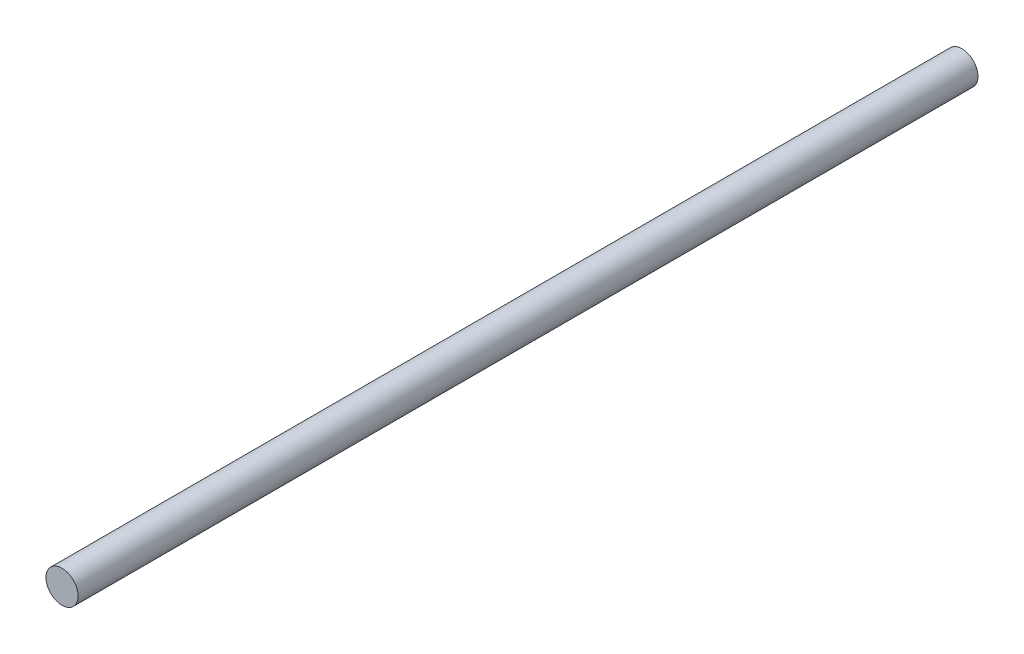
from build123d import *

# Parameters (mm, degrees)
SKETCH1_R           = 4
BOSS_EXTRUDE1_DEPTH = 112


with BuildPart() as part:
    # Sketch1 → Boss-Extrude1 (new, symmetric)
    with BuildSketch(Plane.XY):
        Circle(SKETCH1_R)
    extrude(amount=BOSS_EXTRUDE1_DEPTH, both=True)


solid = part.part
